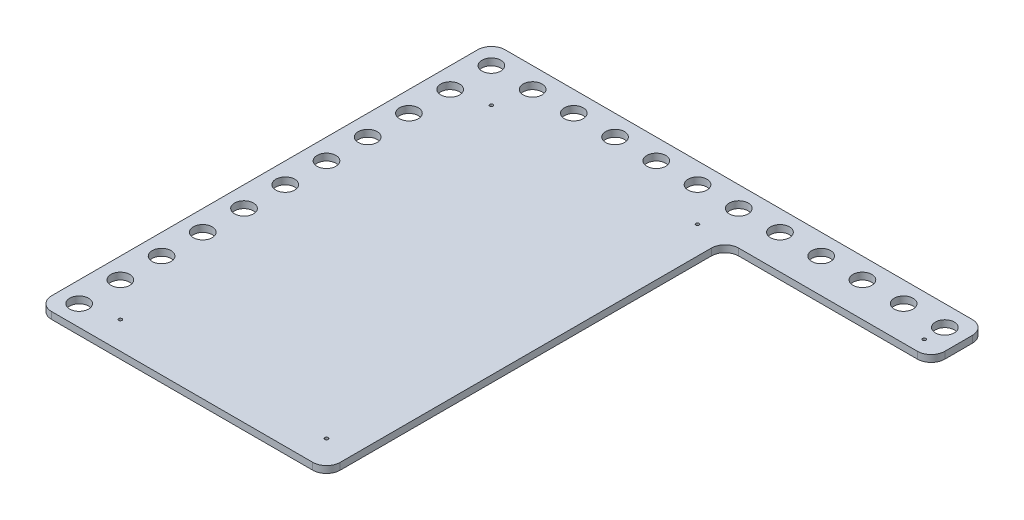
from build123d import *

# Parameters (mm, degrees)
SKETCH1_W           = 571.5
SKETCH1_H           = 419.1
BOSS_EXTRUDE1_DEPTH = 3.175
SKETCH2_R           = 4.4196
CUT_EXTRUDE1_DEPTH  = 355.407375064
SKETCH3_R           = 8.73125
CUT_EXTRUDE2_DEPTH  = 355.407375064
CUT_EXTRUDE5_DEPTH  = 355.407375064
SKETCH5_R           = 1.5113
CUT_EXTRUDE3_DEPTH  = 355.407375064
FILLET1_R           = 12.7


with BuildPart() as part:
    # Sketch1 → Boss-Extrude1 (new, symmetric)
    with BuildSketch(Plane(origin=(0, 0, 0), x_dir=(1, 0, 0), z_dir=(0, 1, 0))):
        Rectangle(SKETCH1_W, SKETCH1_H)
    extrude(amount=BOSS_EXTRUDE1_DEPTH, both=True)

    # Sketch2 → Cut-Extrude1 (cut, through all)
    with BuildSketch(Plane(origin=(0, 3.175, 0), x_dir=(1, 0, 0), z_dir=(0, 1, 0))):
        with Locations(Location((-228.6, 190.5, 0), (0, 0, 270))):
            Circle(SKETCH2_R)
        with Locations(Location((-190.5, 190.5, 0), (0, 0, 270))):
            Circle(SKETCH2_R)
        with Locations(Location((-152.4, 190.5, 0), (0, 0, 270))):
            Circle(SKETCH2_R)
        with Locations(Location((-114.3, 190.5, 0), (0, 0, 270))):
            Circle(SKETCH2_R)
        with Locations(Location((-76.2, 190.5, 0), (0, 0, 270))):
            Circle(SKETCH2_R)
        with Locations(Location((-38.1, 190.5, 0), (0, 0, 270))):
            Circle(SKETCH2_R)
        with Locations(Location((0, 190.5, 0), (0, 0, 270))):
            Circle(SKETCH2_R)
        with Locations(Location((38.1, 190.5, 0), (0, 0, 270))):
            Circle(SKETCH2_R)
        with Locations(Location((-266.7, 38.1, 0), (0, 0, 270))):
            Circle(SKETCH2_R)
        with Locations(Location((-266.7, 76.2, 0), (0, 0, 270))):
            Circle(SKETCH2_R)
        with Locations(Location((-266.7, 114.3, 0), (0, 0, 270))):
            Circle(SKETCH2_R)
        with Locations(Location((-266.7, 152.4, 0), (0, 0, 270))):
            Circle(SKETCH2_R)
        with Locations(Location((-266.7, 190.5, 0), (0, 0, 270))):
            Circle(SKETCH2_R)
        with Locations(Location((-266.7, -190.5, 0), (0, 0, 90))):
            Circle(SKETCH2_R)
        with Locations(Location((-266.7, -152.4, 0), (0, 0, 90))):
            Circle(SKETCH2_R)
        with Locations(Location((-266.7, -114.3, 0), (0, 0, 90))):
            Circle(SKETCH2_R)
        with Locations(Location((-266.7, -76.2, 0), (0, 0, 90))):
            Circle(SKETCH2_R)
        with Locations(Location((-266.7, -38.1, 0), (0, 0, 90))):
            Circle(SKETCH2_R)
        with Locations(Location((-266.7, 0, 0), (0, 0, 90))):
            Circle(SKETCH2_R)
        with Locations(Location((76.2, 190.5, 0), (0, 0, 270))):
            Circle(SKETCH2_R)
        with Locations(Location((114.3, 190.5, 0), (0, 0, 270))):
            Circle(SKETCH2_R)
        with Locations(Location((152.4, 190.5, 0), (0, 0, 270))):
            Circle(SKETCH2_R)
        with Locations(Location((190.5, 190.5, 0), (0, 0, 270))):
            Circle(SKETCH2_R)
        with Locations(Location((228.6, 190.5, 0), (0, 0, 270))):
            Circle(SKETCH2_R)
        with Locations(Location((266.7, 190.5, 0), (0, 0, 270))):
            Circle(SKETCH2_R)
    extrude(amount=-CUT_EXTRUDE1_DEPTH, mode=Mode.SUBTRACT)

    # Sketch3 → Cut-Extrude2 (cut, through all)
    with BuildSketch(Plane(origin=(0, 3.175, 0), x_dir=(1, 0, 0), z_dir=(0, 1, 0))):
        with Locations(Location((-266.7, 190.5, 0), (0, 0, 270))):
            Circle(SKETCH3_R)
        with Locations(Location((-228.6, 190.5, 0), (0, 0, 270))):
            Circle(SKETCH3_R)
        with Locations(Location((-190.5, 190.5, 0), (0, 0, 270))):
            Circle(SKETCH3_R)
        with Locations(Location((-152.4, 190.5, 0), (0, 0, 270))):
            Circle(SKETCH3_R)
        with Locations(Location((-114.3, 190.5, 0), (0, 0, 270))):
            Circle(SKETCH3_R)
        with Locations(Location((-76.2, 190.5, 0), (0, 0, 270))):
            Circle(SKETCH3_R)
        with Locations(Location((-38.1, 190.5, 0), (0, 0, 270))):
            Circle(SKETCH3_R)
        with Locations(Location((0, 190.5, 0), (0, 0, 270))):
            Circle(SKETCH3_R)
        with Locations(Location((38.1, 190.5, 0), (0, 0, 270))):
            Circle(SKETCH3_R)
        with Locations(Location((76.2, 190.5, 0), (0, 0, 270))):
            Circle(SKETCH3_R)
        with Locations(Location((114.3, 190.5, 0), (0, 0, 270))):
            Circle(SKETCH3_R)
        with Locations(Location((152.4, 190.5, 0), (0, 0, 270))):
            Circle(SKETCH3_R)
        with Locations(Location((190.5, 190.5, 0), (0, 0, 270))):
            Circle(SKETCH3_R)
        with Locations(Location((228.6, 190.5, 0), (0, 0, 270))):
            Circle(SKETCH3_R)
        with Locations(Location((266.7, 190.5, 0), (0, 0, 270))):
            Circle(SKETCH3_R)
        with Locations(Location((-266.7, 152.4, 0), (0, 0, 270))):
            Circle(SKETCH3_R)
        with Locations(Location((-266.7, 114.3, 0), (0, 0, 270))):
            Circle(SKETCH3_R)
        with Locations(Location((-266.7, 76.2, 0), (0, 0, 270))):
            Circle(SKETCH3_R)
        with Locations(Location((-266.7, 38.1, 0), (0, 0, 270))):
            Circle(SKETCH3_R)
        with Locations(Location((-266.7, 0, 0), (0, 0, 270))):
            Circle(SKETCH3_R)
        with Locations(Location((-266.7, -38.1, 0), (0, 0, 270))):
            Circle(SKETCH3_R)
        with Locations(Location((-266.7, -76.2, 0), (0, 0, 270))):
            Circle(SKETCH3_R)
        with Locations(Location((-266.7, -114.3, 0), (0, 0, 270))):
            Circle(SKETCH3_R)
        with Locations(Location((-266.7, -152.4, 0), (0, 0, 270))):
            Circle(SKETCH3_R)
        with Locations(Location((-266.7, -190.5, 0), (0, 0, 270))):
            Circle(SKETCH3_R)
    extrude(amount=-CUT_EXTRUDE2_DEPTH, mode=Mode.SUBTRACT)

    # Sketch8 → Cut-Extrude5 (cut, through all)
    with BuildSketch(Plane(origin=(0, 3.175, 0), x_dir=(1, 0, 0), z_dir=(0, 1, 0))):
        Polygon((-19.05, -209.55), (285.75, -209.55), (285.75, 209.55), (171.45, 209.55), (171.45, 158.75), (-19.05, 158.75), align=None)
    extrude(amount=-CUT_EXTRUDE5_DEPTH, mode=Mode.SUBTRACT)

    # Sketch5 → Cut-Extrude3 (cut, through all)
    with BuildSketch(Plane(origin=(0, 3.175, 0), x_dir=(1, 0, 0), z_dir=(0, 1, 0))):
        with Locations(Location((-234.95, -184.15, 0), (0, 0, 270))):
            Circle(SKETCH5_R)
        with Locations(Location((-234.95, 158.75, 0), (0, 0, 270))):
            Circle(SKETCH5_R)
        with Locations(Location((-44.45, -184.15, 0), (0, 0, 270))):
            Circle(SKETCH5_R)
        with Locations(Location((-44.45, 158.75, 0), (0, 0, 270))):
            Circle(SKETCH5_R)
        with Locations(Location((152.4, 171.45, 0), (0, 0, 270))):
            Circle(SKETCH5_R)
    extrude(amount=-CUT_EXTRUDE3_DEPTH, mode=Mode.SUBTRACT)

    # Fillet1
    fillet1_edges = [part.edges().sort_by_distance(p)[0] for p in [
        (-19.05, 0, 209.55),
        (-19.05, 0, -158.75),
        (171.45, 0, -158.75),
        (171.45, 0, -209.55),
        (-285.75, 0, 209.55),
        (-285.75, 0, -209.55),
    ]]
    fillet(fillet1_edges, radius=FILLET1_R)


solid = part.part
